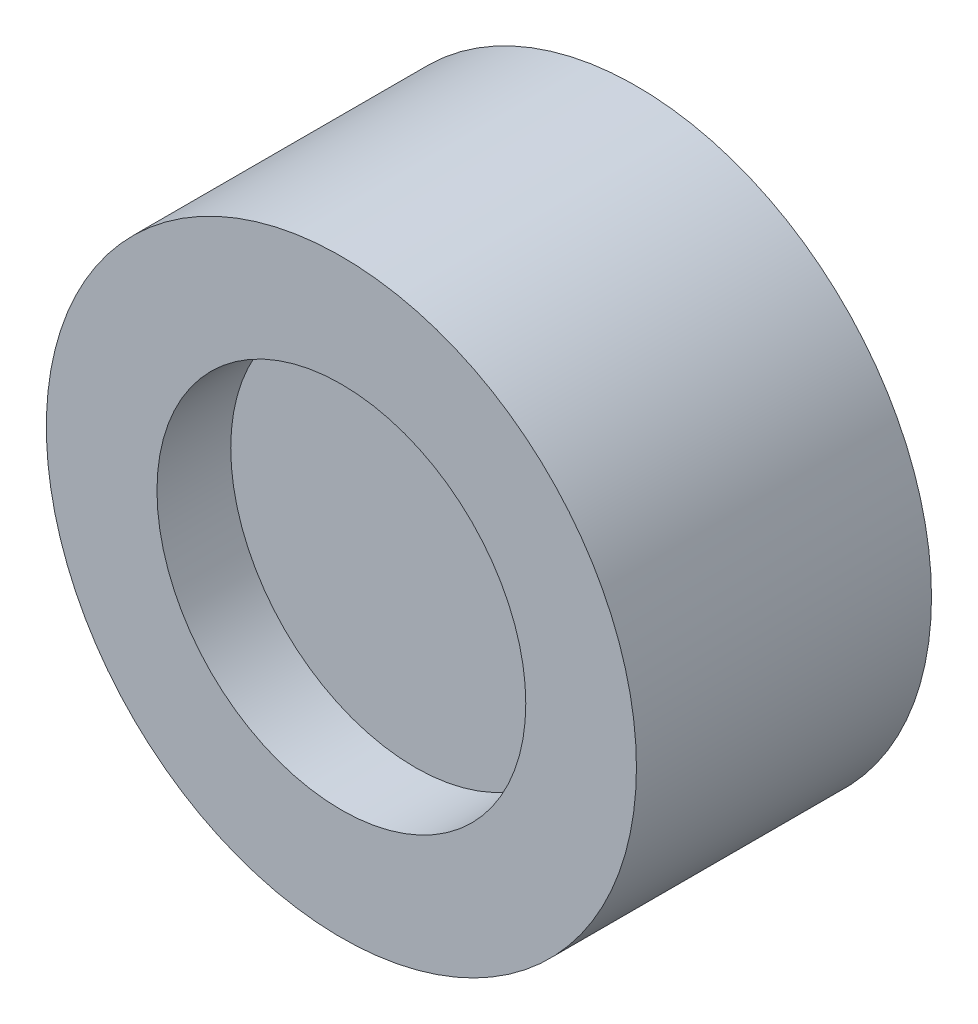
from build123d import *

# Parameters (mm, degrees)
SKETCH1_R           = 20
BOSS_EXTRUDE1_DEPTH = 10
SKETCH2_R           = 12.5
CUT_EXTRUDE1_DEPTH  = 5


with BuildPart() as part:
    # Sketch1 → Boss-Extrude1 (new, symmetric)
    with BuildSketch(Plane.XY):
        Circle(SKETCH1_R)
    extrude(amount=BOSS_EXTRUDE1_DEPTH, both=True)

    # Sketch2 → Cut-Extrude1 (cut)
    with BuildSketch(Plane.XY.offset(10)):
        Circle(SKETCH2_R)
    extrude(amount=-CUT_EXTRUDE1_DEPTH, mode=Mode.SUBTRACT)


solid = part.part
